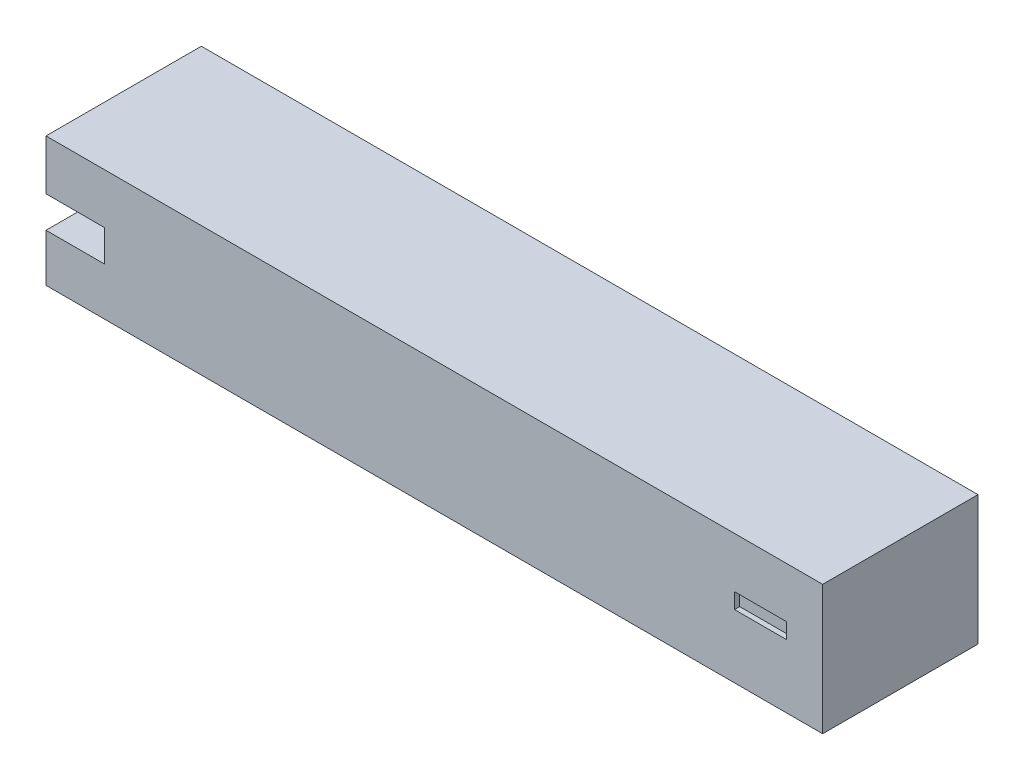
from build123d import *

# Parameters (mm, degrees)
SKETCH1_W           = 300
SKETCH1_H           = 50
BOSS_EXTRUDE1_DEPTH = 60
SKETCH5_W           = 22.63
SKETCH5_H           = 12.19
CUT_EXTRUDE2_DEPTH  = 12.84
SKETCH4_W           = 20
SKETCH4_H           = 6
CUT_EXTRUDE3_DEPTH  = 2


with BuildPart() as part:
    # Sketch1 → Boss-Extrude1 (new body)
    with BuildSketch(Plane.XY):
        with Locations((150, -25)):
            Rectangle(SKETCH1_W, SKETCH1_H)
    extrude(amount=BOSS_EXTRUDE1_DEPTH)

    # Sketch5 → Cut-Extrude2 (cut)
    with BuildSketch(Plane.XY.offset(60)):
        with Locations((11.315, -25.468667548)):
            Rectangle(SKETCH5_W, SKETCH5_H)
    extrude(amount=-CUT_EXTRUDE2_DEPTH, mode=Mode.SUBTRACT)

    # Sketch4 → Cut-Extrude3 (cut)
    with BuildSketch(Plane.XY.offset(60)):
        with Locations((275.959149907, -22.479653517)):
            Rectangle(SKETCH4_W, SKETCH4_H)
    extrude(amount=-CUT_EXTRUDE3_DEPTH, mode=Mode.SUBTRACT)


solid = part.part
